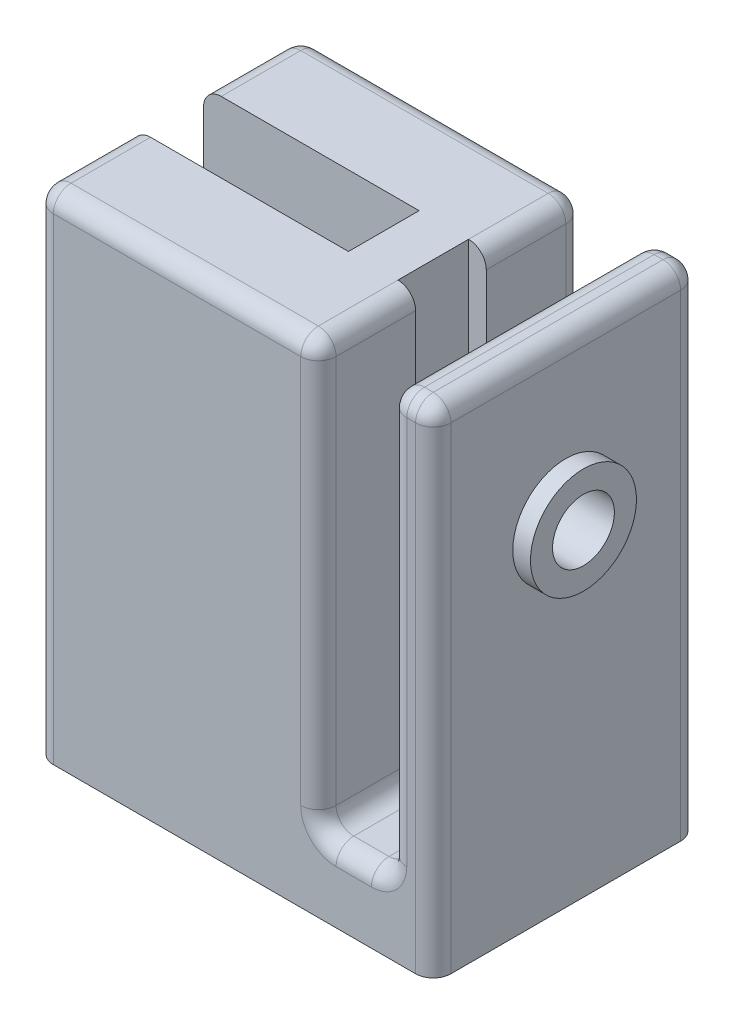
from build123d import *

# Parameters (mm, degrees)
ESQUISSE1_W                                 = 45
ESQUISSE1_H                                 = 30
BOSS_EXTRU_1_DEPTH                          = 8
ESQUISSE5_W                                 = 30
ESQUISSE5_H                                 = 48
BOSS_EXTRU_3_DEPTH                          = 32
ENL_V_MAT_EXTRU_1_DEPTH                     = 27
ESQUISSE14_W                                = 6
ESQUISSE14_H                                = 8
ENL_V_MAT_EXTRU_2_DEPTH                     = 65.600696591
D_GAGEMENT_M31_D                            = 3.2
D_GAGEMENT_M31_DEPTH                        = 7
D_GAGEMENT_M31_TIP                          = 0.96137699
ESQUISSE16_W                                = 30
ESQUISSE16_H                                = 48
ESQUISSE16_R                                = 3.5
BOSS_EXTRU_4_DEPTH                          = 5
CONG_1_R                                    = 2
ESQUISSE17_W                                = 10
ESQUISSE17_H                                = 10
ENL_V_MAT_EXTRU_3_DEPTH                     = 2
BOSS_EXTRU_5_START                          = 2
ESQUISSE18_R                                = 6
ESQUISSE18_R_2                              = 3.5
BOSS_EXTRU_5_DEPTH                          = 2
FRAISAGE_POUR_VIS_T_TE_FRAIS_E_M31_AT_COUNT = 2
FRAISAGE_POUR_VIS_T_TE_FRAIS_E_M31_AT_PITCH = 15
ESQUISSE24_W                                = 8
ESQUISSE24_H                                = 8
BOSS_EXTRU_6_DEPTH                          = 2.6


with BuildPart() as part:
    # Esquisse1 → Boss.-Extru.1 (new body)
    with BuildSketch(Plane(origin=(0, 0, 0), x_dir=(1, 0, 0), z_dir=(0, 1, 0))):
        with Locations((6, 0)):
            Rectangle(ESQUISSE1_W, ESQUISSE1_H)
    extrude(amount=BOSS_EXTRU_1_DEPTH)

    # Esquisse5 → Boss.-Extru.3 (add)
    with BuildSketch(Plane.ZY.offset(16.5)):
        with Locations((0, 32)):
            Rectangle(ESQUISSE5_W, ESQUISSE5_H)
    extrude(amount=-BOSS_EXTRU_3_DEPTH)

    # Esquisse6 → Enlèv. mat.-Extru.1 (cut)
    with BuildSketch(Plane.ZY.offset(16.5)):
        Polygon((10.25, 48), (4, 48), (4, 56), (-4, 56), (-4, 48), (-10.25, 48), (-10.25, 8), (10.25, 8), align=None)
    extrude(amount=-ENL_V_MAT_EXTRU_1_DEPTH, mode=Mode.SUBTRACT)

    # Esquisse14 → Enlèv. mat.-Extru.2 (cut, through all)
    with BuildSketch(Plane(origin=(0, 56, 0), x_dir=(1, 0, 0), z_dir=(0, 1, 0))):
        with Locations((16.5, 0)):
            Rectangle(ESQUISSE14_W, ESQUISSE14_H)
    extrude(amount=-ENL_V_MAT_EXTRU_2_DEPTH, mode=Mode.SUBTRACT)

    # Dégagement M31
    with Locations(Plane.ZY.offset(16.5)):
        with Locations((5, 4), (-5, 4)):
            Hole(D_GAGEMENT_M31_D / 2, depth=D_GAGEMENT_M31_DEPTH)
            with Locations((0, 0, -(D_GAGEMENT_M31_DEPTH + D_GAGEMENT_M31_TIP / 2))):  # 118° drill point
                Cone(0, D_GAGEMENT_M31_D / 2, D_GAGEMENT_M31_TIP, mode=Mode.SUBTRACT)

    # Esquisse16 → Boss.-Extru.4 (add)
    with BuildSketch(Plane(origin=(28.5, 0, 0), x_dir=(0, 0, -1), z_dir=(1, 0, 0))):
        with Locations((0, 32)):
            Rectangle(ESQUISSE16_W, ESQUISSE16_H)
        with Locations((0, 38)):
            Circle(ESQUISSE16_R, mode=Mode.SUBTRACT)
    extrude(amount=-BOSS_EXTRU_4_DEPTH)

    # Congé1
    cong_1_edges = [part.edges().sort_by_distance(p)[0] for p in [
        (19.5, 8, -15),
        (19.5, 8, 15),
        (28.5, 28, 15),
        (28.5, 28, -15),
        (-16.5, 28, 15),
        (-16.5, 28, -15),
        (-16.5, 56, -9.5),
        (-16.5, 56, 9.5),
        (15.5, 8, -9.5),
        (15.5, 8, 9.5),
        (-0.5, 56, -15),
        (15.5, 32, -15),
        (-0.5, 56, 15),
        (15.5, 32, 15),
        (15.5, 56, -9.5),
        (15.5, 56, 9.5),
        (26, 56, 15),
        (23.5, 56, 0),
        (26, 56, -15),
        (28.5, 56, 0),
        (23.5, 8, 0),
        (23.5, 32, -15),
        (23.5, 32, 15),
    ]]
    fillet(cong_1_edges, radius=CONG_1_R)

    # Esquisse17 → Enlèv. mat.-Extru.3 (cut)
    with BuildSketch(Plane.ZY.offset(-23.5)):
        with Locations((0, 38)):
            Rectangle(ESQUISSE17_W, ESQUISSE17_H)
    extrude(amount=-ENL_V_MAT_EXTRU_3_DEPTH, mode=Mode.SUBTRACT)

    # Esquisse18 → Boss.-Extru.5 (add)
    with BuildSketch(Plane(origin=(28.5, 0, 0), x_dir=(0, 0, -1), z_dir=(1, 0, 0)).offset(BOSS_EXTRU_5_START)):
        with Locations((0, 38)):
            Circle(ESQUISSE18_R)
        with Locations((0, 38)):
            Circle(ESQUISSE18_R_2, mode=Mode.SUBTRACT)
    extrude(amount=-BOSS_EXTRU_5_DEPTH)

    # Esquisse23 → Fraisage pour vis à tête fraisée M31 (revolve, cut)
    with BuildSketch(Plane(origin=(-7.5, 8, 0), x_dir=(0, 0, 1), z_dir=(1, 0, 0))):
        Polygon((0, 0), (0, 8), (1.7, 8), (1.7, 1.45), (3.15, 0), align=None)
    fraisage_pour_vis_t_te_frais_e_m31 = revolve(axis=Axis((-7.5, 14.35, 0), (0, -1, 0)), mode=Mode.SUBTRACT)

    # Fraisage pour vis à tête fraisée M31 at: Fraisage pour vis à tête fraisée M31 ×2
    with Locations(*[(i * FRAISAGE_POUR_VIS_T_TE_FRAIS_E_M31_AT_PITCH, 0, 0) for i in range(1, FRAISAGE_POUR_VIS_T_TE_FRAIS_E_M31_AT_COUNT)]):
        add(fraisage_pour_vis_t_te_frais_e_m31, mode=Mode.SUBTRACT)

    # Esquisse24 → Boss.-Extru.6 (add)
    with BuildSketch(Plane.ZY.offset(-10.5)):
        with Locations((0, 52)):
            Rectangle(ESQUISSE24_W, ESQUISSE24_H)
    extrude(amount=BOSS_EXTRU_6_DEPTH)


solid = part.part
